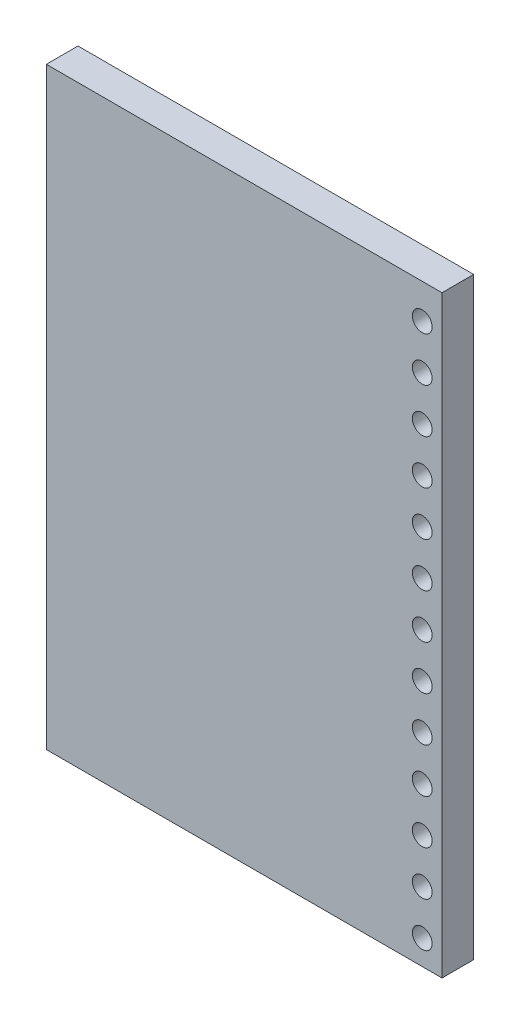
from build123d import *

# Parameters (mm, degrees)
SKETCH1_W           = 200
SKETCH1_H           = 300
BOSS_EXTRUDE1_DEPTH = 16
SKETCH2_R           = 5
CUT_EXTRUDE3_DEPTH  = 317.632278835
LPATTERN1_COUNT     = 13
LPATTERN1_PITCH     = 22.5


with BuildPart() as part:
    # Sketch1 → Boss-Extrude1 (new body)
    with BuildSketch(Plane.XY):
        with Locations((0, 150)):
            Rectangle(SKETCH1_W, SKETCH1_H)
    extrude(amount=BOSS_EXTRUDE1_DEPTH)

    # Sketch2 → Cut-Extrude3 (cut, symmetric)
    with BuildSketch(Plane.XY.offset(16)):
        with Locations((90, 12.5)):
            Circle(SKETCH2_R)
    cut_extrude3 = extrude(amount=CUT_EXTRUDE3_DEPTH, both=True, mode=Mode.SUBTRACT)

    # LPattern1: Cut-Extrude3 ×13
    with Locations(*[(0, i * LPATTERN1_PITCH, 0) for i in range(1, LPATTERN1_COUNT)]):
        add(cut_extrude3, mode=Mode.SUBTRACT)


solid = part.part
